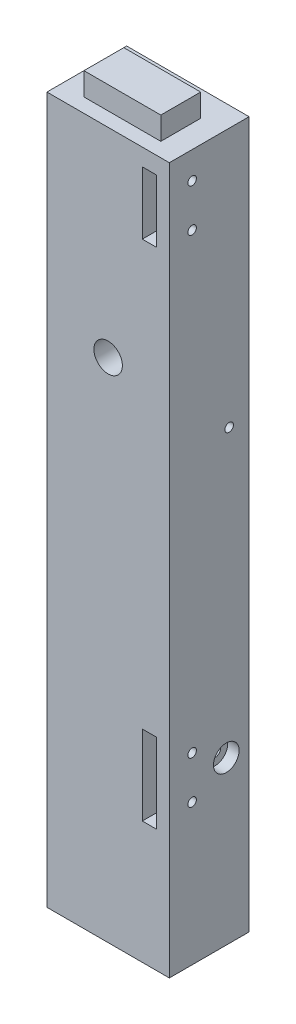
from build123d import *

# Parameters (mm, degrees)
SKETCH1_W           = 136.525
SKETCH1_H           = 787.4
BOSS_EXTRUDE1_DEPTH = 88.9
SKETCH2_W           = 85.725
SKETCH2_H           = 44.45
BOSS_EXTRUDE2_DEPTH = 25.4
SKETCH4_W           = 44.45
SKETCH4_H           = 495.3
CUT_EXTRUDE1_DEPTH  = 44.45
SKETCH4_3_R         = 31.75
SKETCH4_3_R_2       = 15.875
CUT_EXTRUDE2_DEPTH  = 12.7
SKETCH4_4_R         = 15.875
CUT_EXTRUDE3_DEPTH  = 434.829216289
SKETCH5_W           = 44.45
SKETCH5_H           = 76.2
CUT_EXTRUDE4_DEPTH  = 19.05
SKETCH5_3_R         = 4.7625
CUT_EXTRUDE5_DEPTH  = 450.652194062
SKETCH6_W           = 15.875
SKETCH6_H           = 88.9
SKETCH6_H_2         = 69.85
CUT_EXTRUDE6_DEPTH  = 50.8
SKETCH7_R           = 4.7625
CUT_EXTRUDE7_DEPTH  = 44.45
SKETCH8_R           = 14.2875
SKETCH8_R_2         = 6.35
CUT_EXTRUDE8_DEPTH  = 12.7
SKETCH8_3_R         = 6.35
CUT_EXTRUDE9_DEPTH  = 450.652194062


with BuildPart() as part:
    # Sketch1 → Boss-Extrude1 (new body)
    with BuildSketch(Plane.XY):
        Rectangle(SKETCH1_W, SKETCH1_H)
    extrude(amount=BOSS_EXTRUDE1_DEPTH)

    # Sketch2 → Boss-Extrude2 (add)
    with BuildSketch(Plane(origin=(0, 393.7, 0), x_dir=(1, 0, 0), z_dir=(0, 1, 0))):
        with Locations((0, -50.8)):
            Rectangle(SKETCH2_W, SKETCH2_H)
    extrude(amount=BOSS_EXTRUDE2_DEPTH)

    # Sketch4 → Cut-Extrude1 (cut)
    with BuildSketch(Plane(origin=(0, 0, 0), x_dir=(-1, 0, 0), z_dir=(0, 0, -1))):
        with Locations((0, -120.65)):
            Rectangle(SKETCH4_W, SKETCH4_H)
    extrude(amount=-CUT_EXTRUDE1_DEPTH, mode=Mode.SUBTRACT)

    # Sketch4<3> → Cut-Extrude2 (cut)
    with BuildSketch(Plane(origin=(0, 0, 0), x_dir=(-1, 0, 0), z_dir=(0, 0, -1))):
        with Locations((0, 171.45)):
            Circle(SKETCH4_3_R)
        with Locations((0, 171.45)):
            Circle(SKETCH4_3_R_2, mode=Mode.SUBTRACT)
    extrude(amount=-CUT_EXTRUDE2_DEPTH, mode=Mode.SUBTRACT)

    # Sketch4<4> → Cut-Extrude3 (cut, through all)
    with BuildSketch(Plane(origin=(0, 0, 0), x_dir=(-1, 0, 0), z_dir=(0, 0, -1))):
        with Locations((0, 171.45)):
            Circle(SKETCH4_4_R)
    extrude(amount=-CUT_EXTRUDE3_DEPTH, mode=Mode.SUBTRACT)

    # Sketch5 → Cut-Extrude4 (cut)
    with BuildSketch(Plane.ZY.offset(68.2625)):
        with Locations((38.1, -212.725)):
            Rectangle(SKETCH5_W, SKETCH5_H)
    extrude(amount=-CUT_EXTRUDE4_DEPTH, mode=Mode.SUBTRACT)

    # Sketch5<3> → Cut-Extrude5 (cut, through all)
    with BuildSketch(Plane.ZY.offset(68.2625)):
        with Locations((22.225, 104.775)):
            Circle(SKETCH5_3_R)
    extrude(amount=-CUT_EXTRUDE5_DEPTH, mode=Mode.SUBTRACT)

    # Sketch6 → Cut-Extrude6 (cut)
    with BuildSketch(Plane.XY.offset(88.9)):
        with Locations((46.0375, -212.725)):
            Rectangle(SKETCH6_W, SKETCH6_H)
        with Locations((46.0375, 339.725)):
            Rectangle(SKETCH6_W, SKETCH6_H_2)
    extrude(amount=-CUT_EXTRUDE6_DEPTH, mode=Mode.SUBTRACT)

    # Sketch7 → Cut-Extrude7 (cut)
    with BuildSketch(Plane(origin=(68.2625, 0, 0), x_dir=(0, 0, -1), z_dir=(1, 0, 0))):
        with Locations((-63.5, -188.9125)):
            Circle(SKETCH7_R)
        with Locations((-63.5, -236.5375)):
            Circle(SKETCH7_R)
        with Locations((-63.5, 363.5375)):
            Circle(SKETCH7_R)
        with Locations((-63.5, 315.9125)):
            Circle(SKETCH7_R)
    extrude(amount=-CUT_EXTRUDE7_DEPTH, mode=Mode.SUBTRACT)

    # Sketch8 → Cut-Extrude8 (cut)
    with BuildSketch(Plane(origin=(68.2625, 0, 0), x_dir=(0, 0, -1), z_dir=(1, 0, 0))):
        with Locations((-25.4, -212.725)):
            Circle(SKETCH8_R)
        with Locations((-25.4, -212.725)):
            Circle(SKETCH8_R_2, mode=Mode.SUBTRACT)
    extrude(amount=-CUT_EXTRUDE8_DEPTH, mode=Mode.SUBTRACT)

    # Sketch8<3> → Cut-Extrude9 (cut, through all)
    with BuildSketch(Plane(origin=(68.2625, 0, 0), x_dir=(0, 0, -1), z_dir=(1, 0, 0))):
        with Locations((-25.4, -212.725)):
            Circle(SKETCH8_3_R)
    extrude(amount=-CUT_EXTRUDE9_DEPTH, mode=Mode.SUBTRACT)


solid = part.part
